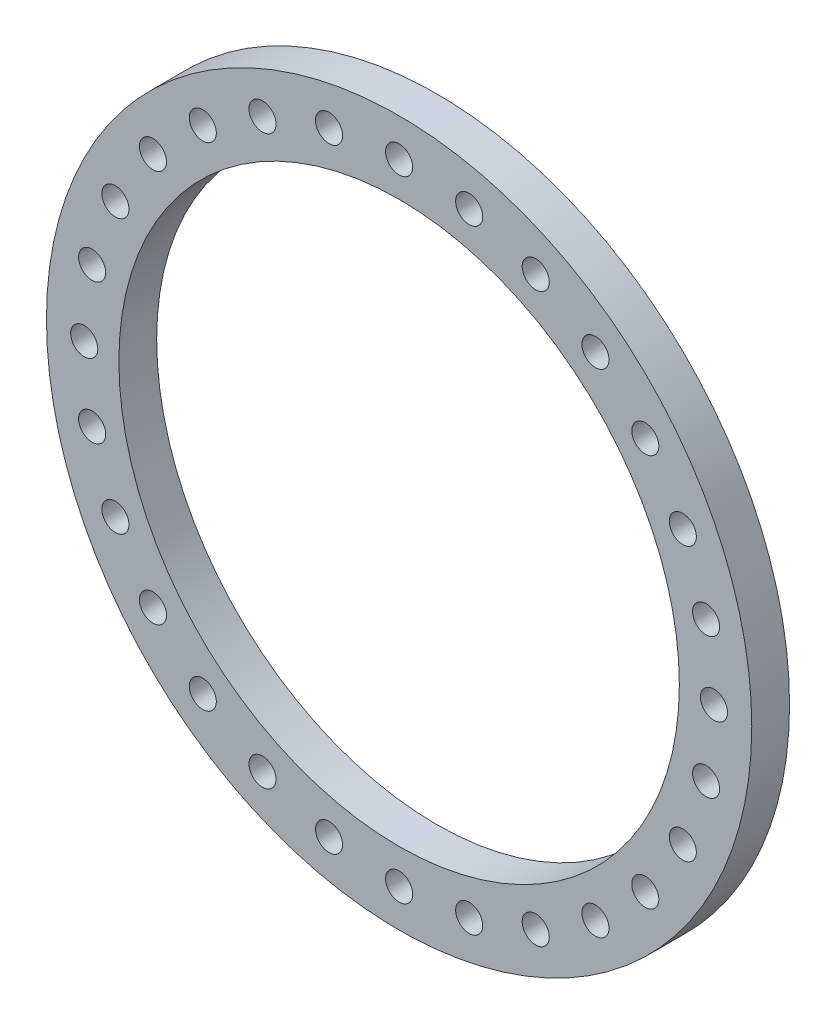
from build123d import *

# Parameters (mm, degrees)
SKETCH_1_R      = 56
SKETCH_1_R_2    = 2.15
SKETCH_1_R_3    = 44.5
EXTRUDE_1_DEPTH = 6


with BuildPart() as part:
    # 草图1 → 凸台-拉伸1 (new body)
    with BuildSketch(Plane(origin=(0, 0, 0), x_dir=(-1, 0, 0), z_dir=(0, 0, -1))):
        with Locations(Location((0, 0, 0), (0, 0, 180))):
            Circle(SKETCH_1_R)
        with Locations(Location((11.126046698, 48.746395609, 0), (0, 0, 180))):
            Circle(SKETCH_1_R_2, mode=Mode.SUBTRACT)
        with Locations(Location((21.694186956, 45.048443395, 0), (0, 0, 180))):
            Circle(SKETCH_1_R_2, mode=Mode.SUBTRACT)
        with Locations(Location((31.174490093, 39.091574123, 0), (0, 0, 180))):
            Circle(SKETCH_1_R_2, mode=Mode.SUBTRACT)
        with Locations(Location((39.091574123, 31.174490093, 0), (0, 0, 180))):
            Circle(SKETCH_1_R_2, mode=Mode.SUBTRACT)
        with Locations(Location((45.048443395, 21.694186956, 0), (0, 0, 180))):
            Circle(SKETCH_1_R_2, mode=Mode.SUBTRACT)
        with Locations(Location((48.746395609, 11.126046698, 0), (0, 0, 180))):
            Circle(SKETCH_1_R_2, mode=Mode.SUBTRACT)
        with Locations(Location((50, 0, 0), (0, 0, 180))):
            Circle(SKETCH_1_R_2, mode=Mode.SUBTRACT)
        with Locations(Location((48.746395609, -11.126046698, 0), (0, 0, 180))):
            Circle(SKETCH_1_R_2, mode=Mode.SUBTRACT)
        with Locations(Location((45.048443395, -21.694186956, 0), (0, 0, 180))):
            Circle(SKETCH_1_R_2, mode=Mode.SUBTRACT)
        with Locations(Location((39.091574123, -31.174490093, 0), (0, 0, 180))):
            Circle(SKETCH_1_R_2, mode=Mode.SUBTRACT)
        with Locations(Location((31.174490093, -39.091574123, 0), (0, 0, 180))):
            Circle(SKETCH_1_R_2, mode=Mode.SUBTRACT)
        with Locations(Location((21.694186956, -45.048443395, 0), (0, 0, 180))):
            Circle(SKETCH_1_R_2, mode=Mode.SUBTRACT)
        with Locations(Location((11.126046698, -48.746395609, 0), (0, 0, 180))):
            Circle(SKETCH_1_R_2, mode=Mode.SUBTRACT)
        with Locations(Location((0, -50, 0), (0, 0, 180))):
            Circle(SKETCH_1_R_2, mode=Mode.SUBTRACT)
        with Locations(Location((-11.126046698, -48.746395609, 0), (0, 0, 180))):
            Circle(SKETCH_1_R_2, mode=Mode.SUBTRACT)
        with Locations(Location((-21.694186956, -45.048443395, 0), (0, 0, 180))):
            Circle(SKETCH_1_R_2, mode=Mode.SUBTRACT)
        with Locations(Location((-31.174490093, -39.091574123, 0), (0, 0, 180))):
            Circle(SKETCH_1_R_2, mode=Mode.SUBTRACT)
        with Locations(Location((-39.091574123, -31.174490093, 0), (0, 0, 180))):
            Circle(SKETCH_1_R_2, mode=Mode.SUBTRACT)
        with Locations(Location((-45.048443395, -21.694186956, 0), (0, 0, 180))):
            Circle(SKETCH_1_R_2, mode=Mode.SUBTRACT)
        with Locations(Location((-48.746395609, -11.126046698, 0), (0, 0, 180))):
            Circle(SKETCH_1_R_2, mode=Mode.SUBTRACT)
        with Locations(Location((-50, 0, 0), (0, 0, 180))):
            Circle(SKETCH_1_R_2, mode=Mode.SUBTRACT)
        with Locations(Location((-48.746395609, 11.126046698, 0), (0, 0, 180))):
            Circle(SKETCH_1_R_2, mode=Mode.SUBTRACT)
        with Locations(Location((-45.048443395, 21.694186956, 0), (0, 0, 180))):
            Circle(SKETCH_1_R_2, mode=Mode.SUBTRACT)
        with Locations(Location((-39.091574123, 31.174490093, 0), (0, 0, 180))):
            Circle(SKETCH_1_R_2, mode=Mode.SUBTRACT)
        with Locations(Location((-31.174490093, 39.091574123, 0), (0, 0, 180))):
            Circle(SKETCH_1_R_2, mode=Mode.SUBTRACT)
        with Locations(Location((-21.694186956, 45.048443395, 0), (0, 0, 180))):
            Circle(SKETCH_1_R_2, mode=Mode.SUBTRACT)
        with Locations(Location((-11.126046698, 48.746395609, 0), (0, 0, 180))):
            Circle(SKETCH_1_R_2, mode=Mode.SUBTRACT)
        with Locations(Location((0, 50, 0), (0, 0, 180))):
            Circle(SKETCH_1_R_2, mode=Mode.SUBTRACT)
        with Locations(Location((0, 0, 0), (0, 0, 180))):
            Circle(SKETCH_1_R_3, mode=Mode.SUBTRACT)
    extrude(amount=-EXTRUDE_1_DEPTH)


solid = part.part
